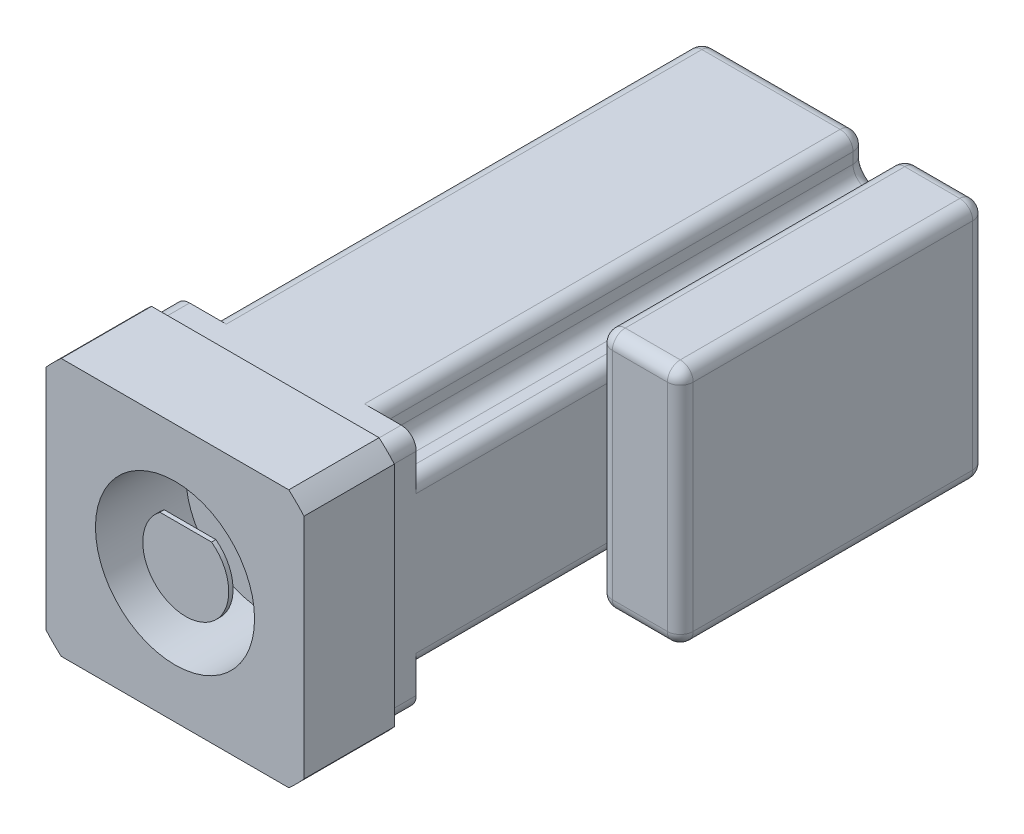
from build123d import *

# Parameters (mm, degrees)
BOSS_EXTRUDE1_DEPTH = 1
BOSS_EXTRUDE2_START = 3.5
SKETCH2_R           = 18.5
BOSS_EXTRUDE2_DEPTH = 21
SKETCH3_W           = 56.2
SKETCH3_H           = 56.2
BOSS_EXTRUDE3_DEPTH = 120.6
SKETCH4_W           = 9.03
SKETCH4_H           = 9.03
CUT_EXTRUDE1_DEPTH  = 113.6
FILLET1_R           = 3.5
FILLET2_R           = 3
FILLET3_R           = 3
SKETCH5_W           = 71
SKETCH5_H           = 56.2
BOSS_EXTRUDE4_DEPTH = 18.8
FILLET5_R           = 3
FILLET7_R           = 3


with BuildPart() as part:
    # Sketch1 → Boss-Extrude1 (new body)
    with BuildSketch(Plane.XY):
        with BuildLine():
            Line((-6, 8), (6, 8))
            ThreePointArc((6, 8), (0, -10), (-6, 8))
        make_face()
    extrude(amount=BOSS_EXTRUDE1_DEPTH)


with BuildPart() as body_2:
    # Sketch2 → Boss-Extrude2 (new body)
    with BuildSketch(Plane.XY.offset(BOSS_EXTRUDE2_START)):
        with BuildLine():
            Line((-26.457513111, 30), (26.457513111, 30))
            ThreePointArc((26.457513111, 30), (28.284271247, 28.284271247), (30, 26.457513111))
            Line((30, 26.457513111), (30, -26.457513111))
            ThreePointArc((30, -26.457513111), (28.284271247, -28.284271247), (26.457513111, -30))
            Line((26.457513111, -30), (-26.457513111, -30))
            ThreePointArc((-26.457513111, -30), (-28.284271247, -28.284271247), (-30, -26.457513111))
            Line((-30, -26.457513111), (-30, 26.457513111))
            ThreePointArc((-30, 26.457513111), (-28.284271247, 28.284271247), (-26.457513111, 30))
        make_face()
        Circle(SKETCH2_R, mode=Mode.SUBTRACT)
    extrude(amount=-BOSS_EXTRUDE2_DEPTH)


with BuildPart() as body_3:
    # Sketch3 → Boss-Extrude3 (new body)
    with BuildSketch(Plane(origin=(0, 0, -17.5), x_dir=(-1, 0, 0), z_dir=(0, 0, -1))):
        Rectangle(SKETCH3_W, SKETCH3_H)
    extrude(amount=BOSS_EXTRUDE3_DEPTH)

    # Sketch4 → Cut-Extrude1 (cut)
    with BuildSketch(Plane(origin=(0, 0, -138.1), x_dir=(-1, 0, 0), z_dir=(0, 0, -1))):
        with Locations((-23.585, 23.585)):
            Rectangle(SKETCH4_W, SKETCH4_H)
        with Locations((23.585, 23.585)):
            Rectangle(SKETCH4_W, SKETCH4_H)
        with Locations((23.585, -23.585)):
            Rectangle(SKETCH4_W, SKETCH4_H)
        with Locations((-23.585, -23.585)):
            Rectangle(SKETCH4_W, SKETCH4_H)
    extrude(amount=-CUT_EXTRUDE1_DEPTH, mode=Mode.SUBTRACT)

    # Fillet1
    fillet1_edges = [body_3.edges().sort_by_distance(p)[0] for p in [
        (28.1, 28.1, -21),
        (19.07, 19.07, -81.3),
        (-28.1, 28.1, -21),
        (-19.07, 19.07, -81.3),
        (-28.1, -28.1, -21),
        (-19.07, -19.07, -81.3),
        (28.1, -28.1, -21),
        (19.07, -19.07, -81.3),
    ]]
    fillet(fillet1_edges, radius=FILLET1_R)

    # Fillet2
    fillet2_edges = [body_3.edges().sort_by_distance(p)[0] for p in [
        (19.07, 28.1, -81.3),
        (28.1, 19.07, -81.3),
        (-19.07, 28.1, -81.3),
        (-28.1, 19.07, -81.3),
        (-19.07, -28.1, -81.3),
        (-28.1, -19.07, -81.3),
        (19.07, -28.1, -81.3),
        (28.1, -19.07, -81.3),
    ]]
    fillet(fillet2_edges, radius=FILLET2_R)

    # Fillet3
    fillet3_edges = [body_3.edges().sort_by_distance(p)[0] for p in [
        (19.07, -23.835, -138.1),
        (0, -28.1, -138.1),
        (-23.835, -19.07, -138.1),
        (-28.1, 0, -138.1),
        (-19.07, 23.835, -138.1),
        (0, 28.1, -138.1),
        (23.835, 19.07, -138.1),
        (28.1, 0, -138.1),
        (-18.191320344, -27.221320344, -138.1),
        (-27.221320344, -18.191320344, -138.1),
        (-27.221320344, 18.191320344, -138.1),
        (-18.191320344, 27.221320344, -138.1),
        (18.191320344, 27.221320344, -138.1),
        (27.221320344, 18.191320344, -138.1),
        (27.221320344, -18.191320344, -138.1),
        (18.191320344, -27.221320344, -138.1),
        (-23.835, 19.07, -138.1),
        (-19.07, -23.835, -138.1),
        (23.835, -19.07, -138.1),
        (19.07, 23.835, -138.1),
        (-20.095126266, 20.095126266, -138.1),
        (-20.095126266, -20.095126266, -138.1),
        (20.095126266, -20.095126266, -138.1),
        (20.095126266, 20.095126266, -138.1),
    ]]
    fillet(fillet3_edges, radius=FILLET3_R)


with BuildPart() as body_4:
    # Sketch5 → Boss-Extrude4 (new body)
    with BuildSketch(Plane(origin=(28.1, 0, 0), x_dir=(0, 0, -1), z_dir=(1, 0, 0))):
        with Locations((102.6, 0)):
            Rectangle(SKETCH5_W, SKETCH5_H)
    extrude(amount=BOSS_EXTRUDE4_DEPTH)

    # Fillet5
    fillet5_edges = [body_4.edges().sort_by_distance(p)[0] for p in [
        (46.9, 28.1, -102.6),
        (46.9, 0, -67.1),
        (28.1, 28.1, -102.6),
        (28.1, -28.1, -102.6),
        (28.1, 0, -67.1),
        (46.9, -28.1, -102.6),
        (37.5, 28.1, -67.1),
        (37.5, -28.1, -67.1),
    ]]
    fillet(fillet5_edges, radius=FILLET5_R)

    # Fillet7
    fillet7_edges = [body_4.edges().sort_by_distance(p)[0] for p in [
        (46.9, 0, -138.1),
        (37.5, 28.1, -138.1),
        (28.1, 0, -138.1),
        (37.5, -28.1, -138.1),
        (46.021320344, -27.221320344, -138.1),
        (28.978679656, -27.221320344, -138.1),
        (28.978679656, 27.221320344, -138.1),
        (46.021320344, 27.221320344, -138.1),
    ]]
    fillet(fillet7_edges, radius=FILLET7_R)


solid = Compound([part.part, body_2.part, body_3.part, body_4.part])
